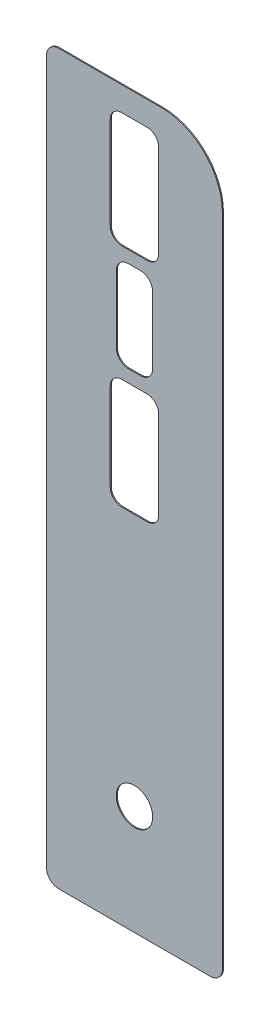
from build123d import *

# Parameters (mm, degrees)
BOSS_EXTRUDE5_DEPTH = 0.17
SKETCH1_R           = 3
CUT_EXTRUDE1_DEPTH  = 62.727456614
CUT_EXTRUDE2_DEPTH  = 62.727456614


with BuildPart() as part:
    # Sketch7 → Boss-Extrude5 (new body)
    with BuildSketch(Plane.XY):
        with BuildLine():
            Line((-12.5, 60), (4.5, 60))
            ThreePointArc((4.5, 60), (11.571067812, 57.071067812), (14.5, 50))
            Line((14.5, 50), (14.5, -58))
            ThreePointArc((14.5, -58), (13.914213562, -59.414213562), (12.5, -60))
            Line((12.5, -60), (-12.5, -60))
            ThreePointArc((-12.5, -60), (-13.914213562, -59.414213562), (-14.5, -58))
            Line((-14.5, -58), (-14.5, 58))
            ThreePointArc((-14.5, 58), (-13.914213562, 59.414213562), (-12.5, 60))
        make_face()
    extrude(amount=BOSS_EXTRUDE5_DEPTH)

    # Sketch1 (on Front Plane) → Cut-Extrude1 (cut, through all)
    with BuildSketch(Plane.XY):
        with Locations((0, -42)):
            Circle(SKETCH1_R)
        with BuildLine():
            Line((-2.1, -0.3), (2.1, -0.3))
            ThreePointArc((2.1, -0.3), (3.443502884, 0.256497116), (4, 1.6))
            Line((4, 1.6), (4, 16.031829774))
            ThreePointArc((4, 16.031829774), (3.443502884, 17.375332658), (2.1, 17.931829774))
            Line((2.1, 17.931829774), (-2.1, 17.931829774))
            ThreePointArc((-2.1, 17.931829774), (-3.443502884, 17.375332658), (-4, 16.031829774))
            Line((-4, 16.031829774), (-4, 1.6))
            ThreePointArc((-4, 1.6), (-3.443502884, 0.256497116), (-2.1, -0.3))
        make_face()
        with BuildLine():
            Line((2.1, 56), (-2.1, 56))
            ThreePointArc((-2.1, 56), (-3.443502884, 55.443502884), (-4, 54.1))
            Line((-4, 54.1), (-4, 38.9))
            ThreePointArc((-4, 38.9), (-3.443502884, 37.556497116), (-2.1, 37))
            Line((-2.1, 37), (2.1, 37))
            ThreePointArc((2.1, 37), (3.443502884, 37.556497116), (4, 38.9))
            Line((4, 38.9), (4, 54.1))
            ThreePointArc((4, 54.1), (3.443502884, 55.443502884), (2.1, 56))
        make_face()
    extrude(amount=CUT_EXTRUDE1_DEPTH, mode=Mode.SUBTRACT)

    # Sketch8 → Cut-Extrude2 (cut, through all)
    with BuildSketch(Plane.XY.offset(0.17)):
        with BuildLine():
            Line((-3, 33), (-3, 22))
            ThreePointArc((-3, 22), (-2.414213562, 20.585786438), (-1, 20))
            Line((-1, 20), (1, 20))
            ThreePointArc((1, 20), (2.414213562, 20.585786438), (3, 22))
            Line((3, 22), (3, 33))
            ThreePointArc((3, 33), (2.414213562, 34.414213562), (1, 35))
            Line((1, 35), (-1, 35))
            ThreePointArc((-1, 35), (-2.414213562, 34.414213562), (-3, 33))
        make_face()
    extrude(amount=-CUT_EXTRUDE2_DEPTH, mode=Mode.SUBTRACT)


solid = part.part
